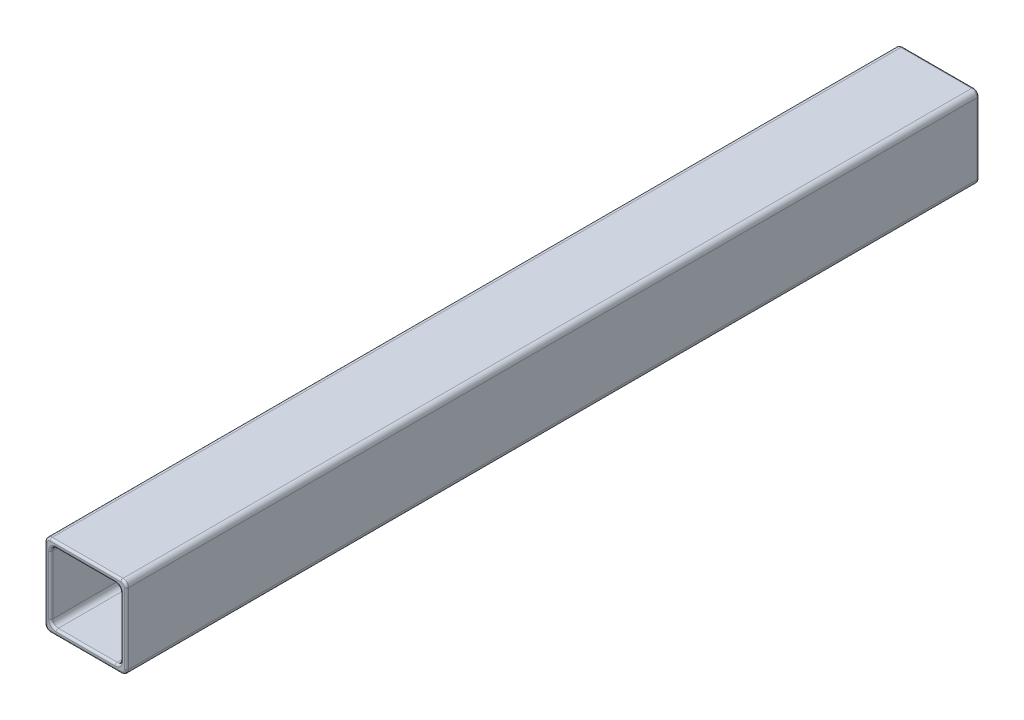
from build123d import *

# Parameters (mm, degrees)
BOSS_EXTRUDE1_DEPTH = 397
BOSS_EXTRUDE2_START = 0.678713738
BOSS_EXTRUDE2_DEPTH = 0.678713738
FILLET1_R           = 1


with BuildPart() as part:
    # Sketch1 → Boss-Extrude1 (new body)
    with BuildSketch(Plane.XY):
        with BuildLine():
            Line((2.54, 0), (35.56, 0))
            ThreePointArc((35.56, 0), (37.356051224, -0.743948776), (38.1, -2.54))
            Line((38.1, -2.54), (38.1, -35.56))
            ThreePointArc((38.1, -35.56), (37.356051224, -37.356051224), (35.56, -38.1))
            Line((35.56, -38.1), (2.54, -38.1))
            ThreePointArc((2.54, -38.1), (0.743948776, -37.356051224), (0, -35.56))
            Line((0, -35.56), (0, -2.54))
            ThreePointArc((0, -2.54), (0.743948776, -0.743948776), (2.54, 0))
        make_face()
        with BuildLine():
            Line((5.3086, -2.7686), (32.7914, -2.7686))
            ThreePointArc((32.7914, -2.7686), (34.587451224, -3.512548776), (35.3314, -5.3086))
            Line((35.3314, -5.3086), (35.3314, -32.7914))
            ThreePointArc((35.3314, -32.7914), (34.587451224, -34.587451224), (32.7914, -35.3314))
            Line((32.7914, -35.3314), (5.3086, -35.3314))
            ThreePointArc((5.3086, -35.3314), (3.512548776, -34.587451224), (2.7686, -32.7914))
            Line((2.7686, -32.7914), (2.7686, -5.3086))
            ThreePointArc((2.7686, -5.3086), (3.512548776, -3.512548776), (5.3086, -2.7686))
        make_face(mode=Mode.SUBTRACT)
    extrude(amount=BOSS_EXTRUDE1_DEPTH)

    # Sketch2 → Boss-Extrude2 (add)
    with BuildSketch(Plane(origin=(0, 0, 0), x_dir=(-1, 0, 0), z_dir=(0, 0, -1)).offset(BOSS_EXTRUDE2_START)):
        with BuildLine():
            Line((0, -35.56), (0, -2.54))
            ThreePointArc((0, -2.54), (-0.743948776, -0.743948776), (-2.54, 0))
            Line((-2.54, 0), (-35.56, 0))
            ThreePointArc((-35.56, 0), (-37.356051224, -0.743948776), (-38.1, -2.54))
            Line((-38.1, -2.54), (-38.1, -35.56))
            ThreePointArc((-38.1, -35.56), (-37.356051224, -37.356051224), (-35.56, -38.1))
            Line((-35.56, -38.1), (-2.54, -38.1))
            ThreePointArc((-2.54, -38.1), (-0.743948776, -37.356051224), (0, -35.56))
        make_face()
        with BuildLine():
            Line((-32.7914, -2.7686), (-5.3086, -2.7686))
            ThreePointArc((-5.3086, -2.7686), (-3.512548776, -3.512548776), (-2.7686, -5.3086))
            Line((-2.7686, -5.3086), (-2.7686, -32.7914))
            ThreePointArc((-2.7686, -32.7914), (-3.512548776, -34.587451224), (-5.3086, -35.3314))
            Line((-5.3086, -35.3314), (-32.7914, -35.3314))
            ThreePointArc((-32.7914, -35.3314), (-34.587451224, -34.587451224), (-35.3314, -32.7914))
            Line((-35.3314, -32.7914), (-35.3314, -5.3086))
            ThreePointArc((-35.3314, -5.3086), (-34.587451224, -3.512548776), (-32.7914, -2.7686))
        make_face(mode=Mode.SUBTRACT)
    extrude(amount=-BOSS_EXTRUDE2_DEPTH)

    # Fillet1
    fillet1_edges = [part.edges().sort_by_distance(p)[0] for p in [
        (37.356051224, -37.356051224, 397),
        (38.1, -19.05, 397),
        (37.356051224, -0.743948776, 397),
        (19.05, 0, 397),
        (0.743948776, -0.743948776, 397),
        (0, -19.05, 397),
        (3.512548776, -34.587451224, 397),
        (19.05, -35.3314, 397),
        (34.587451224, -34.587451224, 397),
        (35.3314, -19.05, 397),
        (34.587451224, -3.512548776, 397),
        (19.05, -2.7686, 397),
        (3.512548776, -3.512548776, 397),
        (2.7686, -19.05, 397),
        (0.743948776, -37.356051224, 397),
        (19.05, -2.7686, -0.678713738),
        (3.512548776, -3.512548776, -0.678713738),
        (2.7686, -19.05, -0.678713738),
        (3.512548776, -34.587451224, -0.678713738),
        (19.05, -35.3314, -0.678713738),
        (34.587451224, -34.587451224, -0.678713738),
        (35.3314, -19.05, -0.678713738),
        (34.587451224, -3.512548776, -0.678713738),
        (19.05, -38.1, -0.678713738),
        (0.743948776, -37.356051224, -0.678713738),
        (0, -19.05, -0.678713738),
        (0.743948776, -0.743948776, -0.678713738),
        (19.05, 0, -0.678713738),
        (37.356051224, -0.743948776, -0.678713738),
        (38.1, -19.05, -0.678713738),
        (37.356051224, -37.356051224, -0.678713738),
        (19.05, -38.1, 397),
    ]]
    fillet(fillet1_edges, radius=FILLET1_R)


solid = part.part
